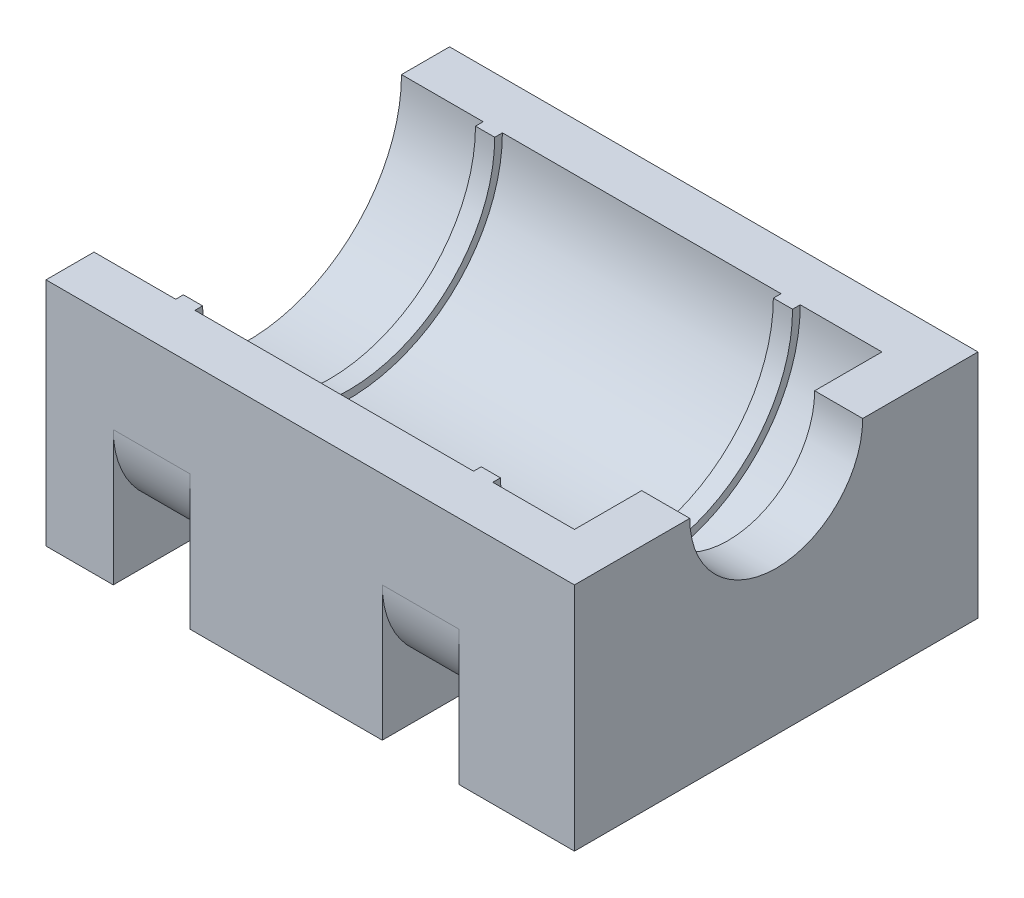
from build123d import *

# Parameters (mm, degrees)
SKETCH1_W           = 27.5
SKETCH1_H           = 21
BOSS_EXTRUDE1_DEPTH = 12
SKETCH4_W           = 4
SKETCH4_H           = 2
CUT_EXTRUDE1_DEPTH  = 28.821978722
FILLET1_R           = 5


with BuildPart() as part:
    # Sketch1 → Boss-Extrude1 (new body)
    with BuildSketch(Plane(origin=(0, 0, 0), x_dir=(1, 0, 0), z_dir=(0, 1, 0))):
        Rectangle(SKETCH1_W, SKETCH1_H)
    extrude(amount=BOSS_EXTRUDE1_DEPTH)

    # Sketch2 → Cut-Revolve1 (revolve, cut)
    with BuildSketch(Plane(origin=(0, 12, 0), x_dir=(1, 0, 0), z_dir=(0, 1, 0))):
        Polygon((-13.75, 0), (13.75, 0), (13.75, 4.5), (11.25, 4.5), (11.25, 8), (7, 8), (7, 7.6), (6, 7.6), (6, 8), (-8.5, 8), (-8.5, 7.6), (-9.5, 7.6), (-9.5, 8), (-13.75, 8), align=None)
    revolve(axis=Axis((-13.75, 12, 0), (1, 0, 0)), mode=Mode.SUBTRACT)

    # Sketch4 → Cut-Extrude1 (cut, through all)
    with BuildSketch(Plane.XY.offset(10.5)):
        with Locations((-8.25, 1)):
            Rectangle(SKETCH4_W, SKETCH4_H)
        with Locations((5.75, 1)):
            Rectangle(SKETCH4_W, SKETCH4_H)
    extrude(amount=-CUT_EXTRUDE1_DEPTH, mode=Mode.SUBTRACT)

    # Fillet1
    fillet1_edges = [part.edges().sort_by_distance(p)[0] for p in [
        (-8.25, 2, -10.5),
        (-8.25, 2, 10.5),
        (5.75, 2, -10.5),
        (5.75, 2, 10.5),
    ]]
    fillet(fillet1_edges, radius=FILLET1_R)


solid = part.part
